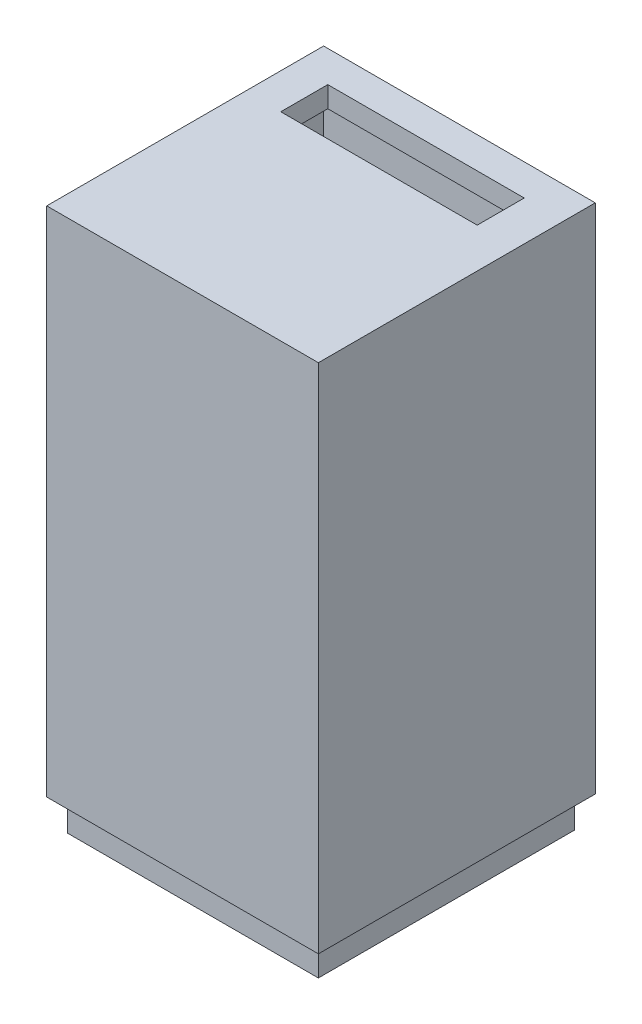
from build123d import *

# Parameters (mm, degrees)
EXTRUDE_1_DEPTH      = 17
EXTRUDE_1_DEPTH_BACK = 5.5
SKETCH_2_W           = 26
SKETCH_2_H           = 51
SKETCH_2_W_2         = 22
SKETCH_2_H_2         = 47
SKETCH_3_W           = 26
SKETCH_3_H           = 51
EXTRUDE_2_DEPTH      = 2
CUT_EXTRUDE_START    = -17
SKETCH_4_W           = 18.8
SKETCH_4_H           = 2
CUT_EXTRUDE_1_DEPTH  = 4.5
SKETCH_5_W           = 26
SKETCH_5_H           = 51
EXTRUDE_3_DEPTH      = 2
SKETCH_6_W           = 26
SKETCH_6_H           = 26.5
CUT_EXTRUDE_2_DEPTH  = 2
SKETCH_7_W           = 24
SKETCH_7_H           = 24.5
SKETCH_7_W_2         = 22
SKETCH_7_H_2         = 22.5
EXTRUDE_4_DEPTH      = 3


with BuildPart() as part:
    # 草图2 → 凸台-拉伸1 (new, two sides: drawn at the far end of the back side and taken through both)
    with BuildSketch(Plane.XY.offset(-EXTRUDE_1_DEPTH_BACK)):
        with Locations((11, 23.5)):
            Rectangle(SKETCH_2_W, SKETCH_2_H)
        with Locations((11, 23.5)):
            Rectangle(SKETCH_2_W_2, SKETCH_2_H_2, mode=Mode.SUBTRACT)
    extrude(amount=EXTRUDE_1_DEPTH + EXTRUDE_1_DEPTH_BACK)

    # 草图3 → 凸台-拉伸2 (add)
    with BuildSketch(Plane(origin=(0, 0, -5.5), x_dir=(-1, 0, 0), z_dir=(0, 0, -1))):
        with Locations((-11, 23.5)):
            Rectangle(SKETCH_3_W, SKETCH_3_H)
    extrude(amount=EXTRUDE_2_DEPTH)

    # 草图4 → 切除-拉伸1 (cut)
    with BuildSketch(Plane.XY.offset(17).offset(CUT_EXTRUDE_START)):
        with Locations((10.8, 48)):
            Rectangle(SKETCH_4_W, SKETCH_4_H)
    extrude(amount=-CUT_EXTRUDE_1_DEPTH, mode=Mode.SUBTRACT)

    # 草图5 → 凸台-拉伸3 (add)
    with BuildSketch(Plane.XY.offset(17)):
        with Locations((11, 23.5)):
            Rectangle(SKETCH_5_W, SKETCH_5_H)
    extrude(amount=EXTRUDE_3_DEPTH)

    # 草图6 → 切除-拉伸2 (cut)
    with BuildSketch(Plane.XZ.offset(2)):
        with Locations((11, 5.75)):
            Rectangle(SKETCH_6_W, SKETCH_6_H)
    extrude(amount=-CUT_EXTRUDE_2_DEPTH, mode=Mode.SUBTRACT)

    # 草图7 → 凸台-拉伸4 (add)
    with BuildSketch(Plane.XZ):
        with Locations((11, 5.750930711)):
            Rectangle(SKETCH_7_W, SKETCH_7_H)
        with Locations((11, 5.75)):
            Rectangle(SKETCH_7_W_2, SKETCH_7_H_2, mode=Mode.SUBTRACT)
    extrude(amount=EXTRUDE_4_DEPTH)


solid = part.part
